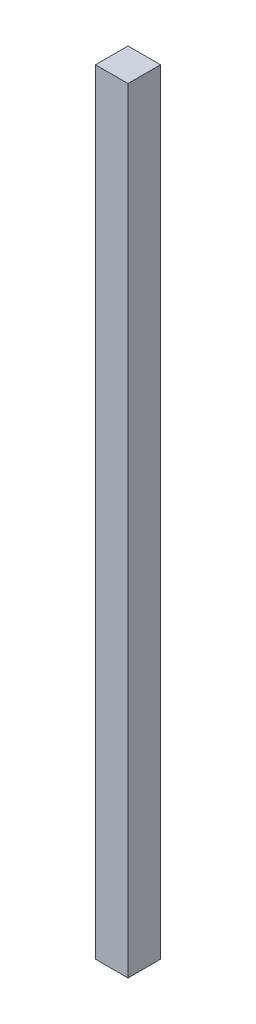
from build123d import *

# Parameters (mm, degrees)
SKETCH1_W           = 10.488088482
SKETCH1_H           = 10.48808848
BOSS_EXTRUDE1_DEPTH = 250


with BuildPart() as part:
    # Sketch1 → Boss-Extrude1 (new body)
    with BuildSketch(Plane(origin=(0, 0, 0), x_dir=(1, 0, 0), z_dir=(0, 1, 0))):
        Rectangle(SKETCH1_W, SKETCH1_H)
    extrude(amount=BOSS_EXTRUDE1_DEPTH)


solid = part.part
